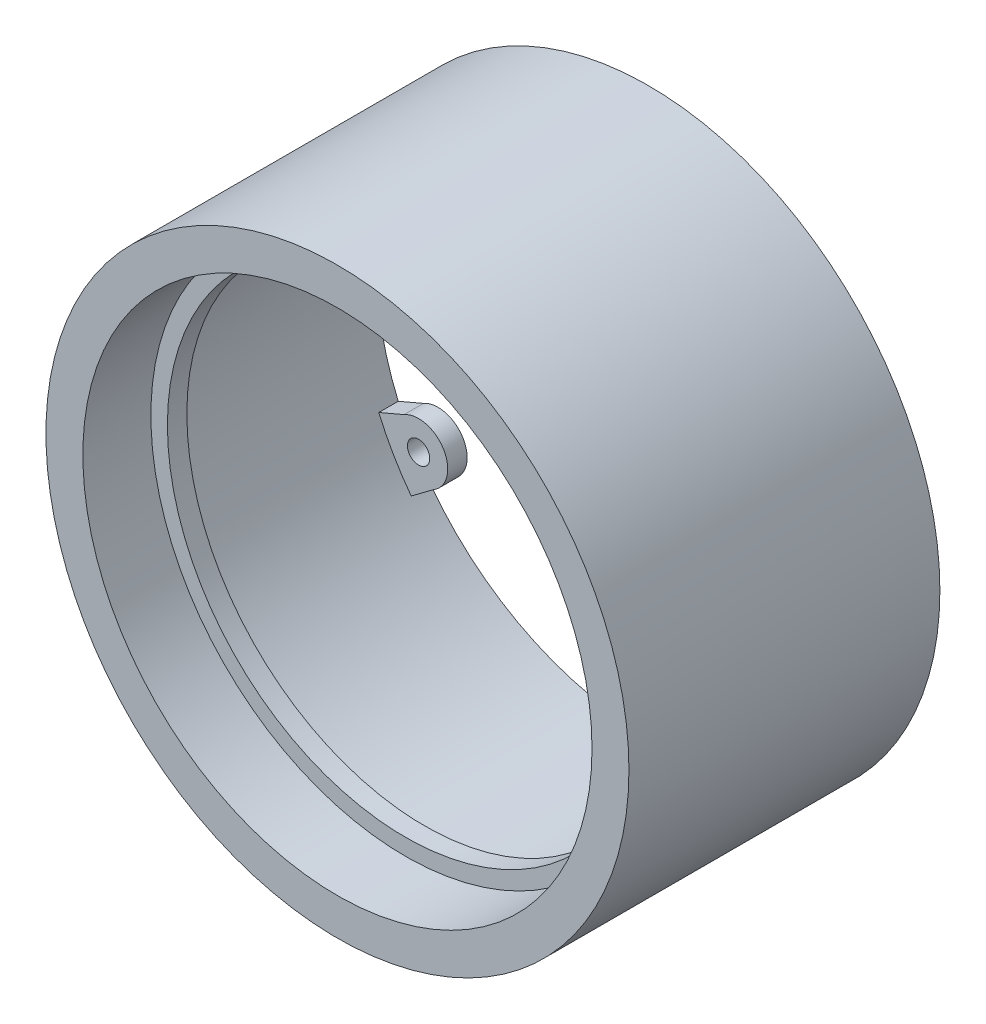
from build123d import *

# Parameters (mm, degrees)
CROQUIS1_R              = 30
CROQUIS1_R_2            = 28
SALIENTE_EXTRUIR1_DEPTH = 23
CROQUIS2_R              = 1.15
SALIENTE_EXTRUIR2_DEPTH = 2
CROQUIS4_R              = 30
CROQUIS4_R_2            = 24.5
SALIENTE_EXTRUIR3_DEPTH = 2
CROQUIS5_R              = 30
CROQUIS5_R_2            = 26.2
SALIENTE_EXTRUIR4_DEPTH = 7


with BuildPart() as part:
    # Croquis1 → Saliente-Extruir1 (new body)
    with BuildSketch(Plane.XY):
        Circle(CROQUIS1_R)
        Circle(CROQUIS1_R_2, mode=Mode.SUBTRACT)
    extrude(amount=SALIENTE_EXTRUIR1_DEPTH)

    # Croquis2 → Saliente-Extruir2 (add)
    # profile 1 of 5: a face of its own
    with BuildSketch(Plane.XY):
        with BuildLine():
            Line((-3, 25), (-3.336066177, 27.800551478))
            ThreePointArc((-3.336066177, 27.800551478), (0, 28), (3.336066177, 27.800551478))
            Line((3.336066177, 27.800551478), (3, 25))
            ThreePointArc((3, 25), (0, 22), (-3, 25))
        make_face()
        with Locations((0, 25)):
            Circle(CROQUIS2_R, mode=Mode.SUBTRACT)
    # profile 2 of 5: a face of its own
    with BuildSketch(Plane.XY):
        with BuildLine():
            Line((20.150635095, 15.098076211), (22.40795073, 16.789393797))
            ThreePointArc((22.40795073, 16.789393797), (24.248711306, 14), (25.744016908, 11.011157681))
            Line((25.744016908, 11.011157681), (23.150635095, 9.901923789))
            ThreePointArc((23.150635095, 9.901923789), (19.052558883, 11), (20.150635095, 15.098076211))
        make_face()
        with Locations((21.650635095, 12.5)):
            Circle(CROQUIS2_R, mode=Mode.SUBTRACT)
    # profile 3 of 5: a face of its own
    with BuildSketch(Plane.XY):
        with BuildLine():
            Line((23.150635095, -9.901923789), (25.744016908, -11.011157681))
            ThreePointArc((25.744016908, -11.011157681), (24.248711306, -14), (22.40795073, -16.789393797))
            Line((22.40795073, -16.789393797), (20.150635095, -15.098076211))
            ThreePointArc((20.150635095, -15.098076211), (19.052558883, -11), (23.150635095, -9.901923789))
        make_face()
        with Locations((21.650635095, -12.5)):
            Circle(CROQUIS2_R, mode=Mode.SUBTRACT)
    # profile 4 of 5: a face of its own
    with BuildSketch(Plane.XY):
        with BuildLine():
            Line((-20.150635095, -15.098076211), (-22.40795073, -16.789393797))
            ThreePointArc((-22.40795073, -16.789393797), (-24.248711306, -14), (-25.744016908, -11.011157681))
            Line((-25.744016908, -11.011157681), (-23.150635095, -9.901923789))
            ThreePointArc((-23.150635095, -9.901923789), (-19.052558883, -11), (-20.150635095, -15.098076211))
        make_face()
        with Locations((-21.650635095, -12.5)):
            Circle(CROQUIS2_R, mode=Mode.SUBTRACT)
    # profile 5 of 5: a face of its own
    with BuildSketch(Plane.XY):
        with BuildLine():
            Line((-23.150635095, 9.901923789), (-25.744016908, 11.011157681))
            ThreePointArc((-25.744016908, 11.011157681), (-24.248711306, 14), (-22.40795073, 16.789393797))
            Line((-22.40795073, 16.789393797), (-20.150635095, 15.098076211))
            ThreePointArc((-20.150635095, 15.098076211), (-19.052558883, 11), (-23.150635095, 9.901923789))
        make_face()
        with Locations((-21.650635095, 12.5)):
            Circle(CROQUIS2_R, mode=Mode.SUBTRACT)
    extrude(amount=SALIENTE_EXTRUIR2_DEPTH)

    # Croquis4 → Saliente-Extruir3 (add)
    with BuildSketch(Plane.XY.offset(23)):
        Circle(CROQUIS4_R)
        Circle(CROQUIS4_R_2, mode=Mode.SUBTRACT)
    extrude(amount=SALIENTE_EXTRUIR3_DEPTH)

    # Croquis5 → Saliente-Extruir4 (add)
    with BuildSketch(Plane.XY.offset(25)):
        Circle(CROQUIS5_R)
        Circle(CROQUIS5_R_2, mode=Mode.SUBTRACT)
    extrude(amount=SALIENTE_EXTRUIR4_DEPTH)


solid = part.part
